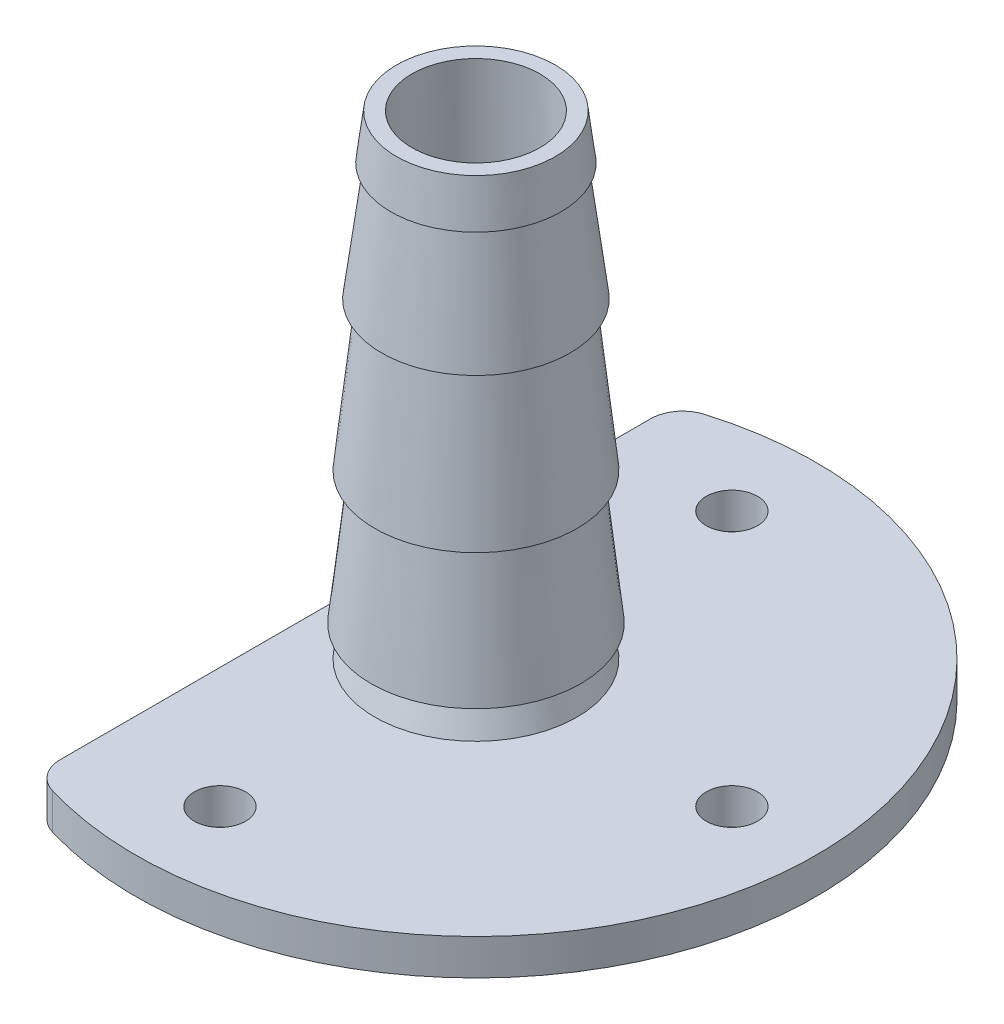
from build123d import *

# Parameters (mm, degrees)
SKETCH_2_R          = 1.6
CUT_EXTRUDE_1_DEPTH = 10
SKETCH_3_R          = 1.6
CUT_EXTRUDE_2_DEPTH = 10
FILLET_1_R          = 2


with BuildPart() as part:
    # 草图1 → 旋转1 (revolve)
    with BuildSketch(Plane.XY, mode=Mode.PRIVATE) as revolve_1_sk:
        with BuildLine():
            Line((4.67441793, 1.645613509), (5.265095642, 0))
            Line((5.265095642, 0), (21.265095642, 0))
            Line((21.265095642, 0), (21.265095642, 2.244719328))
            Line((21.265095642, 2.244719328), (14.3, 2.244719328))
            Line((14.3, 2.244719328), (8.034357928, 2.244719328))
            Line((8.034357928, 2.244719328), (6.321891904, 2.244719328))
            Line((6.321891904, 2.244719328), (5.629770002, 4.172953844))
            Line((5.629770002, 4.172953844), (6.556827402, 4.172953844))
            Line((6.556827402, 4.172953844), (5.659767787, 12.454719003))
            Line((5.659767787, 12.454719003), (6.321891904, 12.454719003))
            Line((6.321891904, 12.454719003), (5.315776989, 21.743296168))
            Line((5.315776989, 21.743296168), (5.894592711, 21.743296168))
            Line((5.894592711, 21.743296168), (4.963884004, 29.092954865))
            Line((4.963884004, 29.092954865), (5.315776989, 29.092954865))
            Line((5.315776989, 29.092954865), (4.963884004, 31.909590534))
            Line((4.963884004, 31.909590534), (4.001695177, 31.909590534))
            Line((4.001695177, 31.909590534), (4.557178871, 2.283793527))
            ThreePointArc((4.557178871, 2.283793527), (4.589745294, 1.959917343), (4.67441793, 1.645613509))
        make_face()
    revolve(revolve_1_sk.sketch.rotate(Axis((0, 0, 0), (0, 1, 0)), 90), axis=Axis((0, 0, 0), (0, 1, 0)))

    # 草图2 → 切除-拉伸1 (cut)
    with BuildSketch(Plane.XZ):
        with Locations(Location((-16, 0, 0), (0, 0, 270))):
            Circle(SKETCH_2_R)
        with Locations(Location((0, -16, 0), (0, 0, 270))):
            Circle(SKETCH_2_R)
        with Locations(Location((16, 0, 0), (0, 0, 270))):
            Circle(SKETCH_2_R)
        with Locations(Location((0, 16, 0), (0, 0, 270))):
            Circle(SKETCH_2_R)
    extrude(amount=-CUT_EXTRUDE_1_DEPTH, mode=Mode.SUBTRACT)

    # 草图3 → 切除-拉伸2 (cut)
    with BuildSketch(Plane(origin=(0, 2.244719328, 0), x_dir=(1, 0, 0), z_dir=(0, 1, 0))):
        with BuildLine():
            ThreePointArc((-7.531954162, 19.886527076), (-21.265095642, 0), (-7.531954162, -19.886527076))
            Line((-7.531954162, -19.886527076), (-7.531954162, 19.886527076))
        make_face()
        with Locations((-16, 0)):
            Circle(SKETCH_3_R, mode=Mode.SUBTRACT)
    extrude(amount=-CUT_EXTRUDE_2_DEPTH, mode=Mode.SUBTRACT)

    # 圆角1
    fillet_1_edges = [part.edges().sort_by_distance(p)[0] for p in [
        (-7.531954162, 1.122359664, 19.886527076),
        (-7.531954162, 1.122359664, -19.886527076),
    ]]
    fillet(fillet_1_edges, radius=FILLET_1_R)


solid = part.part
